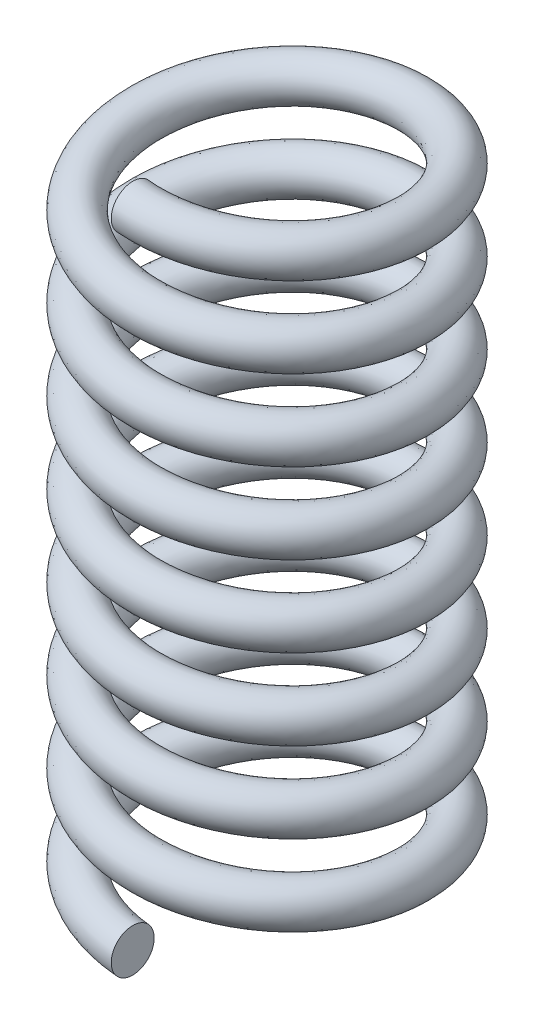
from build123d import *

# Parameters (mm, degrees)
SWEEP1_PITCH  = 15
SWEEP1_HEIGHT = 120
SWEEP1_RADIUS = 25
SKETCH2_R     = 4


with BuildPart() as part:
    # Sweep1: sweep along a helix
    with BuildLine() as sweep1_path:
        Helix(SWEEP1_PITCH, SWEEP1_HEIGHT, SWEEP1_RADIUS, center=(0, 0, 0), direction=(0, 1, 0), lefthand=True)
    # Sketch2 → Sweep1 (sweep)
    with BuildSketch(Plane(origin=(0, 0, 0), x_dir=(0, 0, -1), z_dir=(1, 0, 0))):
        with Locations((-25, 0)):
            Circle(SKETCH2_R)
    sweep(path=sweep1_path.line, is_frenet=True)


solid = part.part
